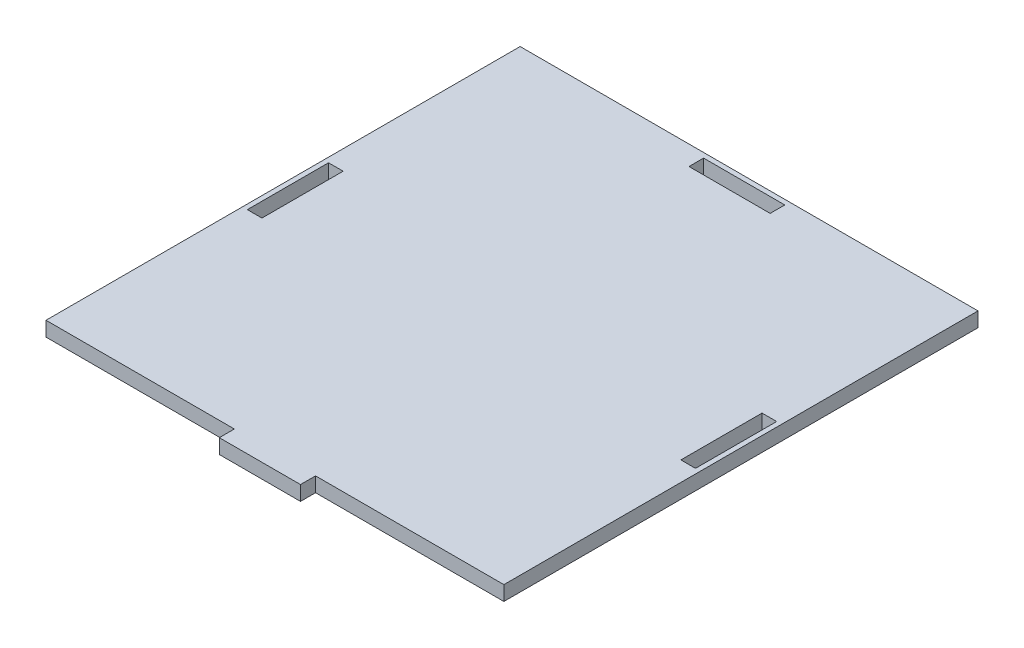
from build123d import *

# Parameters (mm, degrees)
BOSS_EXTRUDE2_DEPTH = 18
SKETCH2_W           = 18
SKETCH2_H           = 100
CUT_EXTRUDE1_DEPTH  = 18
SKETCH3_W           = 100
SKETCH3_H           = 18
CUT_EXTRUDE2_DEPTH  = 18


with BuildPart() as part:
    # Sketch1 → Boss-Extrude2 (new body)
    with BuildSketch(Plane(origin=(0, 0, 0), x_dir=(1, 0, 0), z_dir=(0, 1, 0))):
        Polygon((-282, 292), (282, 292), (282, -292), (50, -292), (50, -310.517979904), (-50, -310.517979904), (-50, -292), (-282, -292), align=None)
    extrude(amount=BOSS_EXTRUDE2_DEPTH)

    # Sketch2 → Cut-Extrude1 (cut)
    with BuildSketch(Plane.XZ):
        with Locations((267, 0)):
            Rectangle(SKETCH2_W, SKETCH2_H)
        with Locations((-267, 0)):
            Rectangle(SKETCH2_W, SKETCH2_H)
    extrude(amount=-CUT_EXTRUDE1_DEPTH, mode=Mode.SUBTRACT)

    # Sketch3 → Cut-Extrude2 (cut)
    with BuildSketch(Plane.XZ):
        with Locations((0, -277)):
            Rectangle(SKETCH3_W, SKETCH3_H)
    extrude(amount=-CUT_EXTRUDE2_DEPTH, mode=Mode.SUBTRACT)


solid = part.part
